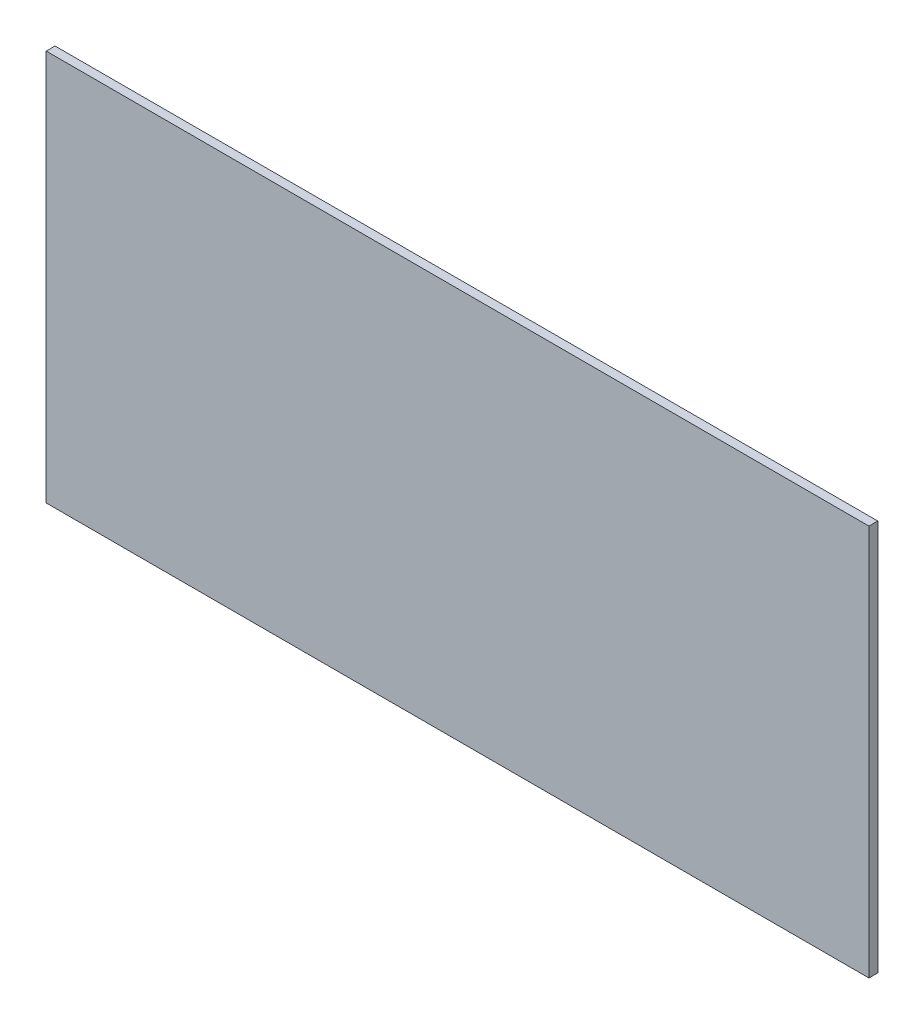
from build123d import *

# Parameters (mm, degrees)
SKETCH1_W           = 467.2
SKETCH1_H           = 222.25
BOSS_EXTRUDE1_DEPTH = 5


with BuildPart() as part:
    # Sketch1 → Boss-Extrude1 (new body)
    with BuildSketch(Plane.XY):
        Rectangle(SKETCH1_W, SKETCH1_H)
    extrude(amount=BOSS_EXTRUDE1_DEPTH)


solid = part.part
